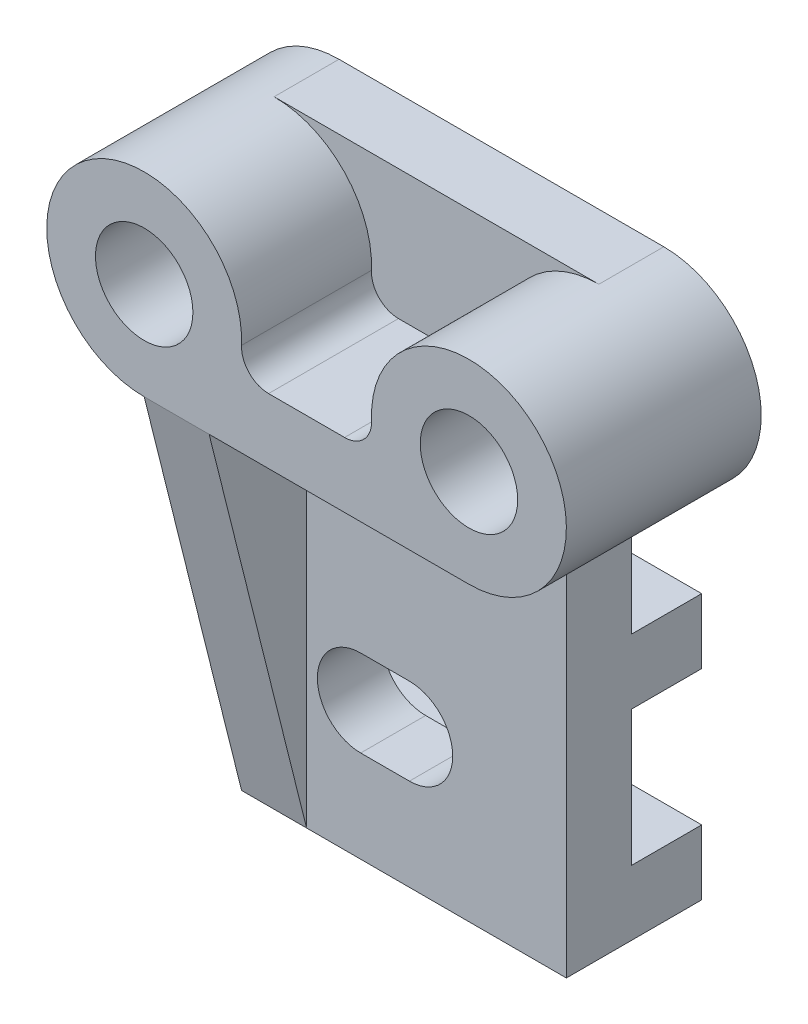
from build123d import *

# Parameters (mm, degrees)
SKETCH1_R           = 9
BOSS_EXTRUDE1_DEPTH = 36
BOSS_EXTRUDE2_DEPTH = 12
SKETCH3_W           = 60
SKETCH3_H           = 72
BOSS_EXTRUDE3_DEPTH = 12
SKETCH4_W           = 13
SKETCH4_H           = 12
BOSS_EXTRUDE4_DEPTH = 60
BOSS_EXTRUDE5_DEPTH = 12


with BuildPart() as part:
    # Sketch1 → Boss-Extrude1 (new body)
    with BuildSketch(Plane.XY):
        with BuildLine():
            Line((0, -18), (60, -18))
            ThreePointArc((60, -18), (72.448153347, 13.001672133), (42.01702128, -0.782608696))
            ThreePointArc((42.01702128, -0.782608696), (40.633325006, -4.457820374), (37.021749414, -6))
            Line((37.021749414, -6), (22.978250586, -6))
            ThreePointArc((22.978250586, -6), (19.366674994, -4.457820374), (17.98297872, -0.782608696))
            ThreePointArc((17.98297872, -0.782608696), (-12.448153347, 13.001672133), (0, -18))
        make_face()
        Circle(SKETCH1_R, mode=Mode.SUBTRACT)
        with Locations((60, 0)):
            Circle(SKETCH1_R, mode=Mode.SUBTRACT)
    extrude(amount=BOSS_EXTRUDE1_DEPTH)

    # Sketch2 → Boss-Extrude2 (add)
    with BuildSketch(Plane(origin=(0, 0, 0), x_dir=(-1, 0, 0), z_dir=(0, 0, -1))):
        with BuildLine():
            Line((-60, 18), (0, 18))
            ThreePointArc((0, 18), (-13.001672133, 12.448153347), (-17.98297872, -0.782608696))
            ThreePointArc((-17.98297872, -0.782608696), (-19.366674994, -4.457820374), (-22.978250586, -6))
            Line((-22.978250586, -6), (-37.021749414, -6))
            ThreePointArc((-37.021749414, -6), (-40.633325006, -4.457820374), (-42.01702128, -0.782608696))
            ThreePointArc((-42.01702128, -0.782608696), (-46.998327867, 12.448153347), (-60, 18))
        make_face()
    extrude(amount=-BOSS_EXTRUDE2_DEPTH)

    # Sketch3 → Boss-Extrude3 (add)
    with BuildSketch(Plane(origin=(0, 0, 6), x_dir=(-1, 0, 0), z_dir=(0, 0, -1))):
        with Locations((-30, -54)):
            Rectangle(SKETCH3_W, SKETCH3_H)
        with BuildLine():
            Line((-31, -57), (-22, -57))
            ThreePointArc((-22, -57), (-14, -65), (-22, -73))
            Line((-22, -73), (-31, -73))
            ThreePointArc((-31, -73), (-39, -65), (-31, -57))
        make_face(mode=Mode.SUBTRACT)
    extrude(amount=-BOSS_EXTRUDE3_DEPTH)

    # Sketch4 → Boss-Extrude4 (add)
    with BuildSketch(Plane(origin=(60, 0, 0), x_dir=(0, 0, -1), z_dir=(1, 0, 0))):
        with Locations((0.5, -47)):
            Rectangle(SKETCH4_W, SKETCH4_H)
        with Locations((0.5, -84)):
            Rectangle(SKETCH4_W, SKETCH4_H)
    extrude(amount=-BOSS_EXTRUDE4_DEPTH)

    # Sketch5 → Boss-Extrude5 (add)
    with BuildSketch(Plane.ZY):
        Polygon((18, -90), (36, -18), (18, -18), align=None)
    extrude(amount=-BOSS_EXTRUDE5_DEPTH)


solid = part.part
